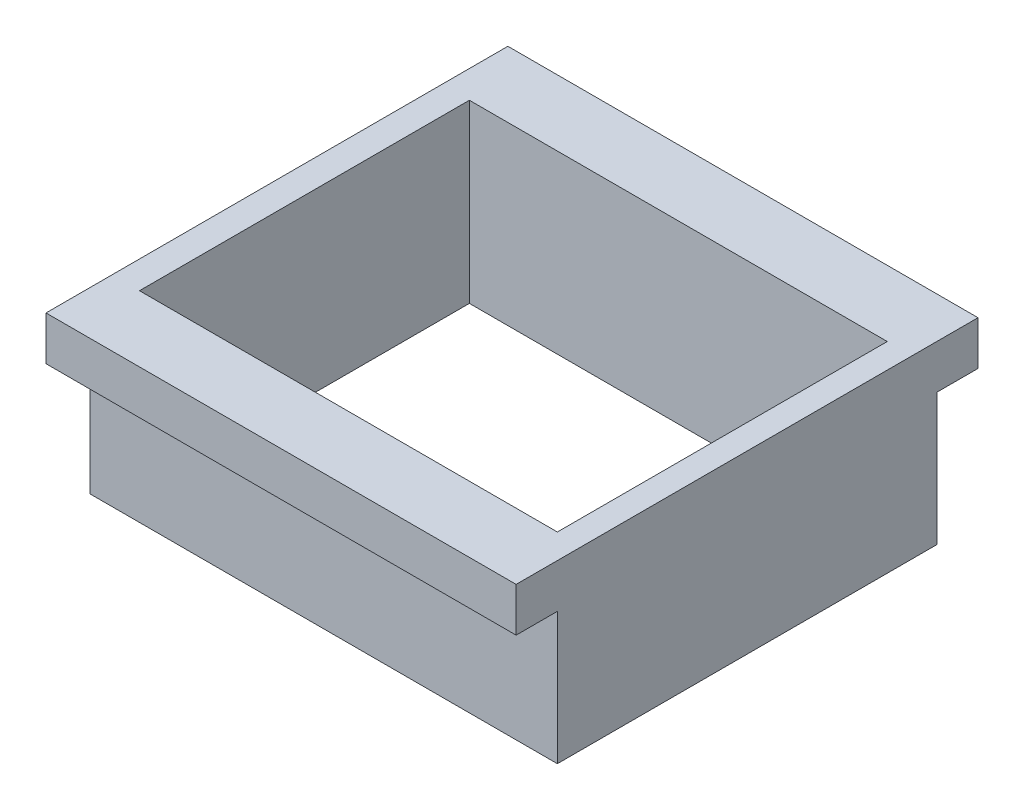
from build123d import *

# Parameters (mm, degrees)
SKETCH_1_W      = 42.5
SKETCH_1_H      = 34.5
SKETCH_1_W_2    = 38
SKETCH_1_H_2    = 30
EXTRUDE_1_DEPTH = 12
SKETCH_2_W      = 42.75
SKETCH_2_H      = 42
SKETCH_2_W_2    = 38
SKETCH_2_H_2    = 30
EXTRUDE_2_DEPTH = 4


with BuildPart() as part:
    # Эскиз1 → Бобышка-Вытянуть1 (new body)
    with BuildSketch(Plane(origin=(0, 0, 0), x_dir=(1, 0, 0), z_dir=(0, 1, 0))):
        Rectangle(SKETCH_1_W, SKETCH_1_H)
        Rectangle(SKETCH_1_W_2, SKETCH_1_H_2, mode=Mode.SUBTRACT)
    extrude(amount=EXTRUDE_1_DEPTH)

    # Эскиз2 → Бобышка-Вытянуть2 (add)
    with BuildSketch(Plane(origin=(0, 12, 0), x_dir=(1, 0, 0), z_dir=(0, 1, 0))):
        with Locations((-0.125, 0)):
            Rectangle(SKETCH_2_W, SKETCH_2_H)
        Rectangle(SKETCH_2_W_2, SKETCH_2_H_2, mode=Mode.SUBTRACT)
    extrude(amount=EXTRUDE_2_DEPTH)


solid = part.part
